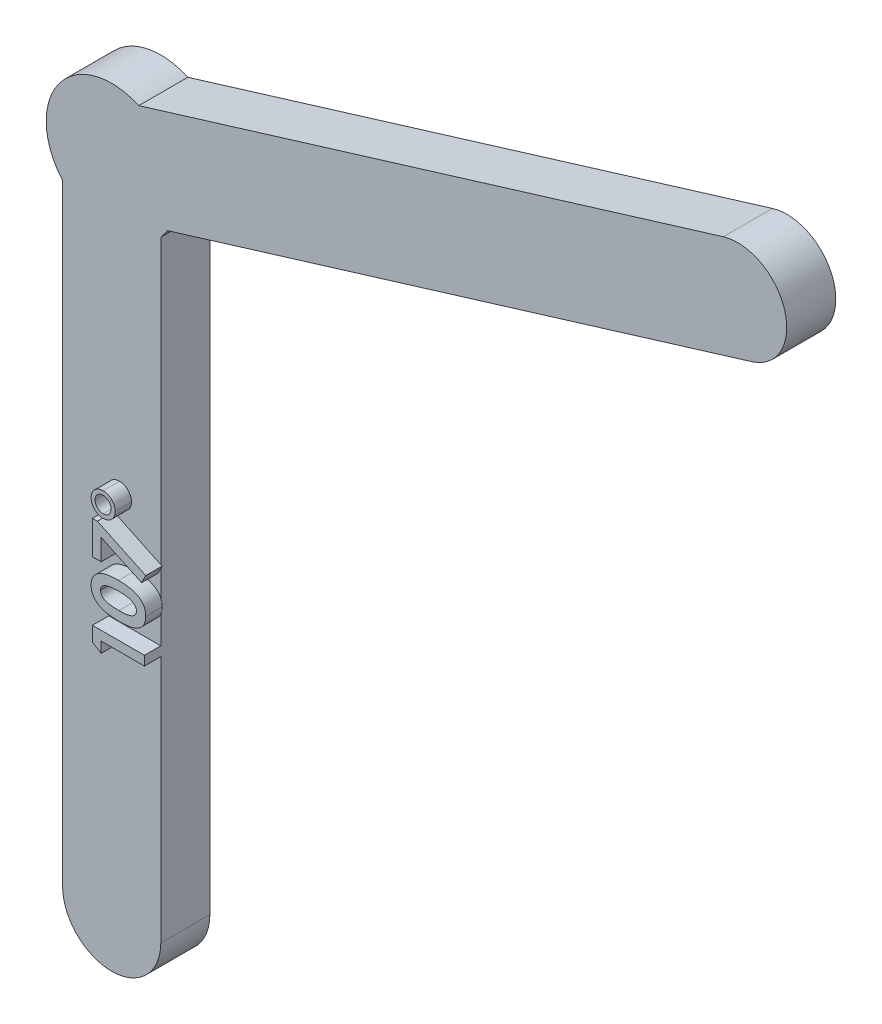
from build123d import *

# Parameters (mm, degrees)
BOSS_EXTRUDE1_DEPTH = 3
BOSS_EXTRUDE2_DEPTH = 1


with BuildPart() as part:
    # Sketch2 → Boss-Extrude1 (new body)
    with BuildSketch(Plane.XY):
        with BuildLine():
            Line((-3, -40), (-3, -2.645751311))
            ThreePointArc((-3, -2.645751311), (-3.215427442, 2.379291147), (1.653029448, 3.642457089))
            Line((1.653029448, 3.642457089), (37.375075124, 14.563782457))
            ThreePointArc((37.375075124, 14.563782457), (41.121104506, 12.571983303), (39.129305353, 8.825953921))
            Line((39.129305353, 8.825953921), (3.407259676, -2.095371447))
            ThreePointArc((3.407259676, -2.095371447), (3.215427442, -2.379291147), (3, -2.645751311))
            Line((3, -2.645751311), (3, -40))
            ThreePointArc((3, -40), (0, -43), (-3, -40))
        make_face()
    extrude(amount=BOSS_EXTRUDE1_DEPTH)

    # Sketch3 → Boss-Extrude2 (add)
    # profile 1 of 4: a face of its own
    with BuildSketch(Plane.XY.offset(3)):
        Polygon((-0.175, -25.154881865), (-0.175, -24.27399745), (3, -24.27399745), (3, -24.843869245), (0.354166667, -24.843869245), (0.354166667, -25.495151297), align=None)
    # profile 2 of 4: a face of its own
    with BuildSketch(Plane.XY.offset(3)):
        with BuildLine():
            add(Edge.make_bspline(
                [(-0.256410256, -22.187223612), (-0.256000846, -22.159639409), (-0.255195836, -22.105401495), (-0.246473924, -22.02552), (-0.233303758, -21.948569182), (-0.214913964, -21.874261296), (-0.19065475, -21.803082912), (-0.161374324, -21.734785029), (-0.126796317, -21.669429262), (-0.086761751, -21.606946387), (-0.040652473, -21.547894496), (0.010185802, -21.491318806), (0.067717809, -21.43948776), (0.130454644, -21.390835172), (0.198771401, -21.345693322), (0.272469109, -21.303770681), (0.352002612, -21.265485151), (0.437488797, -21.230380098), (0.530216664, -21.198990657), (0.631247648, -21.172550921), (0.740605462, -21.149874557), (0.858562124, -21.130734067), (0.985274483, -21.11626696), (1.120658341, -21.106515836), (1.264452704, -21.099824155), (1.363094454, -21.099278026), (1.413772035, -21.09899745)],
                knots=[0, 0, 0, 0, 0.879187688, 1.728717895, 2.558878706, 3.367146394, 4.166631857, 4.95393622, 5.734098362, 6.521634849, 7.316678452, 8.120609651, 8.943639266, 9.781961388, 10.650008082, 11.55217958, 12.483362701, 13.462505087, 14.497127373, 15.602264045, 16.790140859, 18.057036744, 19.411188506, 20.855078804, 22.384284574, 24, 24, 24, 24], degree=3))
            add(Edge.make_bspline(
                [(1.413772035, -21.09899745), (1.465083636, -21.099300727), (1.564781155, -21.099889987), (1.709890925, -21.106237126), (1.846257088, -21.117170742), (1.973869318, -21.131251658), (2.09264741, -21.150576911), (2.202741653, -21.173044562), (2.304172829, -21.200142384), (2.396949232, -21.232384739), (2.482667702, -21.267543829), (2.562361603, -21.305324879), (2.635439661, -21.347366311), (2.704216337, -21.389836589), (2.765684896, -21.437474644), (2.822263901, -21.486752984), (2.87178804, -21.540176006), (2.916848745, -21.595431785), (2.955788395, -21.654560868), (2.989844864, -21.716949245), (3.017468579, -21.783710325), (3.041494248, -21.853626861), (3.058742076, -21.927890678), (3.072427664, -22.005321711), (3.079991159, -22.086794149), (3.080929461, -22.142263866), (3.081410256, -22.170687154)],
                knots=[0, 0, 0, 0, 1.643824397, 3.193921316, 4.652018541, 6.026147715, 7.305813021, 8.506024873, 9.624771103, 10.66654028, 11.650369642, 12.592128821, 13.489360096, 14.35046321, 15.179132238, 15.977837183, 16.751455772, 17.509897991, 18.259653136, 19.016390304, 19.783391144, 20.571659993, 21.382176161, 22.223003704, 23.089447706, 24, 24, 24, 24], degree=3))
            add(Edge.make_bspline(
                [(3.081410256, -22.170687154), (3.080920089, -22.199109624), (3.079959859, -22.254788824), (3.072484978, -22.336482291), (3.058682809, -22.414321079), (3.041375575, -22.489181731), (3.017471846, -22.560488459), (2.989215292, -22.628874266), (2.954465748, -22.692986878), (2.915602853, -22.75414734), (2.870815661, -22.811389711), (2.820807888, -22.865562537), (2.766280514, -22.917423591), (2.705338818, -22.96512523), (2.639096011, -23.009520627), (2.567561271, -23.051080932), (2.490500768, -23.088961965), (2.40793533, -23.12443059), (2.317883816, -23.155810482), (2.21949947, -23.182869572), (2.112045503, -23.205788839), (1.995629446, -23.223802272), (1.870235813, -23.238328502), (1.735965212, -23.249100871), (1.592768059, -23.255486697), (1.494340976, -23.256069291), (1.443664864, -23.256369245)],
                knots=[0, 0, 0, 0, 0.917318694, 1.797013832, 2.644089644, 3.467281984, 4.274391433, 5.068665368, 5.852346333, 6.624865025, 7.405043053, 8.194438745, 9.002823433, 9.831034161, 10.688848002, 11.574933485, 12.499091769, 13.45866927, 14.473616003, 15.574277631, 16.749933499, 18.017757418, 19.374908438, 20.82337846, 22.364486432, 24, 24, 24, 24], degree=3))
            add(Edge.make_bspline(
                [(1.443664864, -23.256369245), (1.373254462, -23.255825542), (1.237396686, -23.25477646), (1.0411217, -23.241481718), (0.859699474, -23.22196841), (0.693433485, -23.193307983), (0.541707931, -23.15786976), (0.405522301, -23.112489271), (0.282992161, -23.060826886), (0.210404568, -23.016803896), (0.175445713, -22.995602018)],
                knots=[0, 0, 0, 0, 1.288568992, 2.486310467, 3.599230591, 4.627010532, 5.572937695, 6.447898582, 7.252493626, 8, 8, 8, 8], degree=3))
            add(Edge.make_bspline(
                [(0.175445713, -22.995602018), (0.141102145, -22.970949484), (0.073953702, -22.922748921), (-0.014199652, -22.838468891), (-0.089592717, -22.747920972), (-0.150519281, -22.649245361), (-0.198565973, -22.544002654), (-0.232500812, -22.431289289), (-0.252272829, -22.311521498), (-0.255010519, -22.229274958), (-0.256410256, -22.187223612)],
                knots=[0, 0, 0, 0, 1.058512271, 2.069600068, 3.047294572, 4.004278952, 4.967380941, 5.939006123, 6.946246673, 8, 8, 8, 8], degree=3))
        make_face()
        with BuildLine():
            add(Edge.make_bspline(
                [(0.313461538, -22.173231224), (0.314647089, -22.198164977), (0.316971398, -22.247048368), (0.336589396, -22.318024416), (0.367119772, -22.384663133), (0.402937146, -22.435915702), (0.437997174, -22.473843075), (0.469692245, -22.50046678), (0.505088209, -22.526130336), (0.5457633, -22.548770627), (0.590374583, -22.570366594), (0.639050565, -22.590819426), (0.692584041, -22.608406161), (0.750614615, -22.625179465), (0.814547313, -22.639686238), (0.884999784, -22.65237958), (0.962212565, -22.663193069), (1.046509296, -22.670991953), (1.137448259, -22.678152731), (1.235421604, -22.683308732), (1.340408748, -22.685459568), (1.412711585, -22.686144155), (1.45002504, -22.68649745)],
                knots=[0, 0, 0, 0, 1.076486532, 2.110485037, 3.16053299, 4.233735637, 4.798028448, 5.389657808, 6.0205397, 6.6857231, 7.399126456, 8.163539924, 8.966557062, 9.834164971, 10.774831688, 11.799768806, 12.928987201, 14.14492726, 15.459726247, 16.873396567, 18.386448164, 20, 20, 20, 20], degree=3))
            add(Edge.make_bspline(
                [(1.45002504, -22.68649745), (1.498366186, -22.685914523), (1.591063917, -22.684796717), (1.72437073, -22.678981137), (1.845884837, -22.667186388), (1.956076433, -22.652860272), (2.054303096, -22.632171296), (2.141437387, -22.608758289), (2.216697621, -22.579702468), (2.280987028, -22.546139154), (2.335677326, -22.508962718), (2.382164459, -22.468606882), (2.42242009, -22.42644467), (2.455119251, -22.381160293), (2.480178379, -22.33286173), (2.498203101, -22.281952199), (2.509236783, -22.228399345), (2.5107668, -22.191726903), (2.511538462, -22.173231224)],
                knots=[0, 0, 0, 0, 1.771738815, 3.39744054, 4.888007323, 6.245018868, 7.467093912, 8.564230264, 9.548241846, 10.417081984, 11.216594933, 11.965786359, 12.669352538, 13.348558586, 14.005353126, 14.656563323, 15.322440191, 16, 16, 16, 16], degree=3))
            add(Edge.make_bspline(
                [(2.511538462, -22.173231224), (2.511010434, -22.155370259), (2.50997662, -22.120400709), (2.499364668, -22.069407274), (2.482111937, -22.021184258), (2.457706739, -21.975877263), (2.426671795, -21.93332423), (2.388870725, -21.893733133), (2.34392674, -21.85740256), (2.310571656, -21.836236203), (2.293384415, -21.825329582)],
                knots=[0, 0, 0, 0, 0.992283464, 1.942767638, 2.88273346, 3.832339453, 4.79467288, 5.803907806, 6.868395428, 8, 8, 8, 8], degree=3))
            add(Edge.make_bspline(
                [(2.293384415, -21.825329582), (2.2698986, -21.812488872), (2.22065075, -21.785562945), (2.137546839, -21.754404216), (2.043819364, -21.728176534), (1.939176634, -21.705602752), (1.823205926, -21.690163662), (1.69664262, -21.676867537), (1.558849395, -21.670454485), (1.463385752, -21.669411367), (1.413772035, -21.668869245)],
                knots=[0, 0, 0, 0, 0.710965849, 1.490837728, 2.352621235, 3.297892224, 4.334225155, 5.461620853, 6.680770821, 8, 8, 8, 8], degree=3))
            add(Edge.make_bspline(
                [(1.413772035, -21.668869245), (1.363727648, -21.669078655), (1.267400744, -21.669481734), (1.129112143, -21.676877059), (1.002808457, -21.687175614), (0.88877167, -21.702239428), (0.786724952, -21.721621762), (0.696674974, -21.745510562), (0.618444263, -21.77367368), (0.552110828, -21.807071781), (0.495736507, -21.844062254), (0.447371712, -21.883328769), (0.406079071, -21.925037363), (0.371703192, -21.969118285), (0.345437441, -22.016591802), (0.326891649, -22.06655111), (0.315672066, -22.119098628), (0.314208327, -22.154943475), (0.313461538, -22.173231224)],
                knots=[0, 0, 0, 0, 1.793836731, 3.452829483, 4.963243077, 6.335886805, 7.574563692, 8.684454726, 9.672768357, 10.54971625, 11.340229787, 12.085688095, 12.778991901, 13.440269426, 14.083255152, 14.715733572, 15.344777694, 16, 16, 16, 16], degree=3))
        make_face(mode=Mode.SUBTRACT)
    # profile 3 of 4: a face of its own
    with BuildSketch(Plane.XY.offset(3)):
        Polygon((-0.175, -20.65124104), (-0.175, -18.61598463), (0.120748197, -18.61598463), (3.081410256, -20.016495447), (2.827003205, -20.521493444), (0.354166667, -19.351221008), (0.354166667, -20.65124104), align=None)
    # profile 4 of 4: a face of its own
    with BuildSketch(Plane.XY.offset(3)):
        with BuildLine():
            add(Edge.make_bspline(
                [(0.476282051, -16.824958989), (0.501543872, -16.825505484), (0.55122174, -16.826580176), (0.624352745, -16.837013476), (0.694208258, -16.854492691), (0.761803607, -16.876903338), (0.825395964, -16.908042089), (0.886396731, -16.944903837), (0.943669883, -16.989402672), (0.9978957, -17.039014969), (1.047295391, -17.093515132), (1.090947065, -17.151405488), (1.127096601, -17.212864468), (1.157366856, -17.276577248), (1.180332148, -17.343408663), (1.196689885, -17.412864586), (1.20741609, -17.485236986), (1.208449037, -17.534503871), (1.208974359, -17.559559349)],
                knots=[0, 0, 0, 0, 1.048753193, 2.062393874, 3.059725798, 4.03711221, 5.013824111, 5.993903926, 6.992478922, 8.020738441, 9.043061753, 10.043343452, 11.026424807, 11.999358773, 12.968420071, 13.955122655, 14.960044262, 16, 16, 16, 16], degree=3))
            add(Edge.make_bspline(
                [(1.208974359, -17.559559349), (1.208454225, -17.584616682), (1.207431478, -17.633887214), (1.196631189, -17.706233128), (1.180530583, -17.775855144), (1.156529218, -17.842391691), (1.126678292, -17.90615653), (1.090260147, -17.967072817), (1.046482503, -18.024600993), (0.996781055, -18.078582797), (0.942375086, -18.128107638), (0.88420218, -18.171482912), (0.823225465, -18.208946116), (0.758107997, -18.237837437), (0.69067286, -18.261947038), (0.619758864, -18.27798784), (0.545943315, -18.288833106), (0.495615647, -18.289833085), (0.469921875, -18.290343604)],
                knots=[0, 0, 0, 0, 1.037227242, 2.039512271, 3.023626077, 3.993053151, 4.963434463, 5.936395473, 6.927031705, 7.952593414, 8.972234493, 9.969891786, 10.954906455, 11.929570282, 12.915563215, 13.916770353, 14.936449251, 16, 16, 16, 16], degree=3))
            add(Edge.make_bspline(
                [(0.469921875, -18.290343604), (0.445290866, -18.289811451), (0.396869022, -18.288765297), (0.325492116, -18.278103661), (0.256787066, -18.261182775), (0.190979117, -18.23681523), (0.128167681, -18.205730248), (0.067236284, -18.169180135), (0.010175979, -18.123937412), (-0.044275745, -18.073515722), (-0.093962638, -18.018218509), (-0.137555056, -17.95952238), (-0.173973759, -17.89802202), (-0.203993097, -17.834134423), (-0.227847104, -17.767768562), (-0.244158222, -17.698411219), (-0.254789074, -17.626671533), (-0.255866772, -17.577830012), (-0.256410256, -17.553199173)],
                knots=[0, 0, 0, 0, 1.027628768, 2.020204677, 3.0054932, 3.977172113, 4.942988595, 5.928118098, 6.937247537, 7.976812879, 9.023474825, 10.036014018, 11.024160528, 12.002107364, 12.979092523, 13.962271943, 14.972371232, 16, 16, 16, 16], degree=3))
            add(Edge.make_bspline(
                [(-0.256410256, -17.553199173), (-0.255881051, -17.528566172), (-0.254836181, -17.479930408), (-0.244068832, -17.408427146), (-0.227959354, -17.339440503), (-0.203981879, -17.27352423), (-0.173948227, -17.210285117), (-0.137706982, -17.149501332), (-0.093944483, -17.091941849), (-0.043999627, -17.038019265), (0.009956511, -16.987787182), (0.068273488, -16.944627592), (0.128824771, -16.907104674), (0.192846684, -16.877455064), (0.259342082, -16.853394895), (0.329176204, -16.837233977), (0.401748506, -16.826543556), (0.451226198, -16.825491671), (0.476282051, -16.824958989)],
                knots=[0, 0, 0, 0, 1.02774298, 2.029191086, 3.012479778, 3.981238486, 4.951290381, 5.931946007, 6.930416638, 7.964088953, 8.997761269, 10.003308488, 10.98854748, 11.966603007, 12.943696749, 13.935593372, 14.954569896, 16, 16, 16, 16], degree=3))
        make_face()
        with BuildLine():
            add(Edge.make_bspline(
                [(0.479462139, -17.069189758), (0.462471258, -17.069424264), (0.428972226, -17.069886612), (0.379883793, -17.077505977), (0.332524379, -17.088023775), (0.287283463, -17.10328392), (0.24427911, -17.123234284), (0.203398935, -17.147571829), (0.164484674, -17.176174899), (0.128492582, -17.209237523), (0.095853701, -17.245103846), (0.066652511, -17.282897251), (0.042455186, -17.323086522), (0.023016589, -17.365273093), (0.006315159, -17.408801858), (-0.003707976, -17.454711924), (-0.01154919, -17.502263298), (-0.011966436, -17.534718897), (-0.012179487, -17.55129112)],
                knots=[0, 0, 0, 0, 1.061159961, 2.092171217, 3.098605391, 4.092036902, 5.070589041, 6.057187883, 7.061962211, 8.084674938, 9.107387665, 10.090954379, 11.06617917, 12.032717429, 12.99305519, 13.973669989, 14.965331307, 16, 16, 16, 16], degree=3))
            add(Edge.make_bspline(
                [(-0.012179487, -17.55129112), (-0.01157068, -17.568051412), (-0.01036426, -17.601263796), (-0.004409395, -17.650200831), (0.007572839, -17.69685371), (0.022606002, -17.742054962), (0.043122897, -17.784898142), (0.067542797, -17.826391236), (0.096744971, -17.865435361), (0.129769422, -17.902214665), (0.165718261, -17.935960463), (0.204573602, -17.964950546), (0.244977971, -17.990352408), (0.287582445, -18.010455361), (0.331832846, -18.026567734), (0.377821945, -18.038209426), (0.425871214, -18.044356322), (0.458458137, -18.045521173), (0.475010016, -18.046112835)],
                knots=[0, 0, 0, 0, 1.042034071, 2.064906527, 3.055369705, 4.030203466, 5.020228521, 6.000742353, 7.017744738, 8.043920206, 9.069249762, 10.075703201, 11.051782302, 12.029903876, 12.99669358, 13.974371501, 14.971122288, 16, 16, 16, 16], degree=3))
            add(Edge.make_bspline(
                [(0.475010016, -18.046112835), (0.491349767, -18.045520146), (0.523514051, -18.044353455), (0.570936909, -18.038223162), (0.616468237, -18.026465839), (0.660506807, -18.010425399), (0.703332854, -17.990458383), (0.743356347, -17.964229259), (0.782721478, -17.935019181), (0.819574977, -17.900938323), (0.853594861, -17.864058718), (0.883277913, -17.824563201), (0.908722399, -17.783622403), (0.929101491, -17.740636346), (0.945194342, -17.696373754), (0.956841315, -17.650387952), (0.962986781, -17.60233779), (0.964151827, -17.56975099), (0.96474359, -17.553199173)],
                knots=[0, 0, 0, 0, 1.017878107, 2.003660885, 2.970612419, 3.939454555, 4.919652619, 5.904816436, 6.913406512, 7.969270601, 9.02513469, 10.033724766, 11.041277553, 12.021475617, 12.990317753, 13.970071221, 14.968938047, 16, 16, 16, 16], degree=3))
            add(Edge.make_bspline(
                [(0.96474359, -17.553199173), (0.964515736, -17.536840687), (0.964066668, -17.504600367), (0.956359019, -17.457448889), (0.946146284, -17.411789288), (0.929505189, -17.368485652), (0.910263551, -17.326033898), (0.884925795, -17.286252494), (0.856415485, -17.247396305), (0.822504018, -17.212069657), (0.787116244, -17.177952839), (0.747777121, -17.149765554), (0.707718654, -17.124520148), (0.665616684, -17.10387006), (0.621397497, -17.089062601), (0.575848465, -17.07693948), (0.528165265, -17.071009446), (0.49579822, -17.069800121), (0.479462139, -17.069189758)],
                knots=[0, 0, 0, 0, 1.029744634, 2.029484694, 3.00508751, 3.97324883, 4.947661161, 5.937798898, 6.940036528, 7.980134083, 9.020231638, 10.033191535, 11.023329272, 12.003497406, 12.979740652, 13.958541426, 14.969648588, 16, 16, 16, 16], degree=3))
        make_face(mode=Mode.SUBTRACT)
    extrude(amount=BOSS_EXTRUDE2_DEPTH)


solid = part.part
